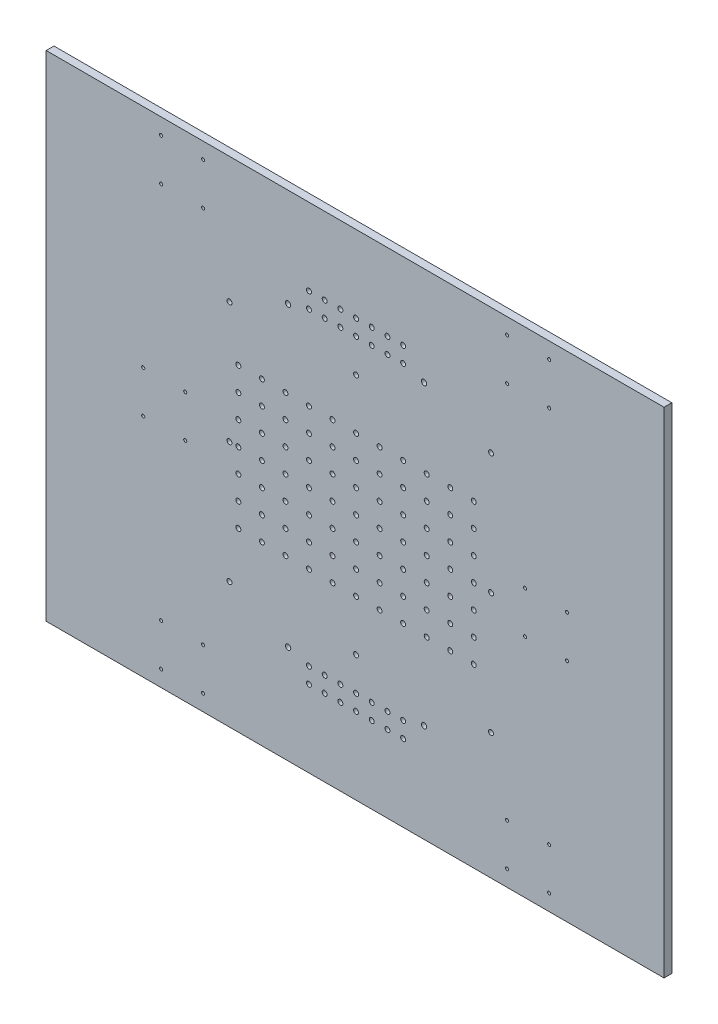
from build123d import *

# Parameters (mm, degrees)
SKETCH1_W                                 = 500
SKETCH1_H                                 = 400
BASE_PLATE_EXTRUDE_DEPTH                  = 6.3
SKETCH2_R                                 = 1.25
TRIPOD_ADAPATER_FASTENERS_THRU_HOLE_DEPTH = 321.218191238
SKETCH3_R                                 = 2
SKETCH3_R_2                               = 2.15
PLATE_TO_PLATE_MNT_THRU_HOLE_DEPTH        = 321.218191238
SKETCH4_R                                 = 2
CENTER_PERFORATION_THRU_HOLE_DEPTH        = 321.218191238
SKETCH5_R                                 = 2
SIDE_PERFORATION_THRU_HOLE_DEPTH          = 321.218191238


with BuildPart() as part:
    # Sketch1 → Base_Plate-Extrude (new body)
    with BuildSketch(Plane.XY):
        Rectangle(SKETCH1_W, SKETCH1_H)
    extrude(amount=BASE_PLATE_EXTRUDE_DEPTH)

    # Sketch2 → Tripod_Adapater_Fasteners-Thru-Hole (cut, through all)
    with BuildSketch(Plane.XY.offset(6.3)):
        with Locations((157, 153)):
            Circle(SKETCH2_R)
        with Locations((157, 187)):
            Circle(SKETCH2_R)
        with Locations((123, 187)):
            Circle(SKETCH2_R)
        with Locations((123, 153)):
            Circle(SKETCH2_R)
        with Locations((157, -153)):
            Circle(SKETCH2_R)
        with Locations((157, -187)):
            Circle(SKETCH2_R)
        with Locations((123, -153)):
            Circle(SKETCH2_R)
        with Locations((123, -187)):
            Circle(SKETCH2_R)
        with Locations((-137.448637287, 17)):
            Circle(SKETCH2_R)
        with Locations((-137.448637287, -17)):
            Circle(SKETCH2_R)
        with Locations((-171.448637287, -17)):
            Circle(SKETCH2_R)
        with Locations((-171.448637287, 17)):
            Circle(SKETCH2_R)
        with Locations(Location((171.448637287, -17, 0), (0, 0, 180))):
            Circle(SKETCH2_R)
        with Locations(Location((171.448637287, 17, 0), (0, 0, 180))):
            Circle(SKETCH2_R)
        with Locations(Location((137.448637287, 17, 0), (0, 0, 180))):
            Circle(SKETCH2_R)
        with Locations(Location((137.448637287, -17, 0), (0, 0, 180))):
            Circle(SKETCH2_R)
        with Locations(Location((-157, -153, 0), (0, 0, 180))):
            Circle(SKETCH2_R)
        with Locations(Location((-123, -153, 0), (0, 0, 180))):
            Circle(SKETCH2_R)
        with Locations(Location((-123, -187, 0), (0, 0, 180))):
            Circle(SKETCH2_R)
        with Locations(Location((-157, -187, 0), (0, 0, 180))):
            Circle(SKETCH2_R)
        with Locations(Location((-157, 187, 0), (0, 0, 180))):
            Circle(SKETCH2_R)
        with Locations(Location((-123, 187, 0), (0, 0, 180))):
            Circle(SKETCH2_R)
        with Locations(Location((-123, 153, 0), (0, 0, 180))):
            Circle(SKETCH2_R)
        with Locations(Location((-157, 153, 0), (0, 0, 180))):
            Circle(SKETCH2_R)
    extrude(amount=-TRIPOD_ADAPATER_FASTENERS_THRU_HOLE_DEPTH, mode=Mode.SUBTRACT)

    # Sketch3 → Plate_to_Plate_Mnt-Thru-Hole (cut, through all)
    with BuildSketch(Plane.XY.offset(6.3)):
        with Locations((110, 98)):
            Circle(SKETCH3_R)
        with Locations((0.78, 98)):
            Circle(SKETCH3_R)
        with Locations((-101.66, 98)):
            Circle(SKETCH3_R)
        with Locations((-101.66, -98)):
            Circle(SKETCH3_R)
        with Locations((0.78, -98)):
            Circle(SKETCH3_R)
        with Locations((110, -98)):
            Circle(SKETCH3_R)
        with Locations((110, 0)):
            Circle(SKETCH3_R)
        with Locations((-101.66, 0)):
            Circle(SKETCH3_R)
        with Locations((55.78, -120.25)):
            Circle(SKETCH3_R_2)
        with Locations((-54.22, -120.25)):
            Circle(SKETCH3_R_2)
        with Locations((-54.22, 120.25)):
            Circle(SKETCH3_R_2)
        with Locations((55.78, 120.25)):
            Circle(SKETCH3_R_2)
    extrude(amount=-PLATE_TO_PLATE_MNT_THRU_HOLE_DEPTH, mode=Mode.SUBTRACT)

    # Sketch4 → Center_Perforation-Thru-Hole (cut, through all)
    with BuildSketch(Plane.XY.offset(6.3)):
        with Locations((-94.47, 0)):
            Circle(SKETCH4_R)
        with Locations((-75.42, 0)):
            Circle(SKETCH4_R)
        with Locations((-56.37, 0)):
            Circle(SKETCH4_R)
        with Locations((-37.32, 0)):
            Circle(SKETCH4_R)
        with Locations((-18.27, 0)):
            Circle(SKETCH4_R)
        with Locations((0.78, 0)):
            Circle(SKETCH4_R)
        with Locations((19.83, 0)):
            Circle(SKETCH4_R)
        with Locations((38.88, 0)):
            Circle(SKETCH4_R)
        with Locations((57.93, 0)):
            Circle(SKETCH4_R)
        with Locations((76.98, 0)):
            Circle(SKETCH4_R)
        with Locations((96.03, 0)):
            Circle(SKETCH4_R)
        with Locations((-94.47, 19.05)):
            Circle(SKETCH4_R)
        with Locations((-75.42, 19.05)):
            Circle(SKETCH4_R)
        with Locations((-56.37, 19.05)):
            Circle(SKETCH4_R)
        with Locations((-37.32, 19.05)):
            Circle(SKETCH4_R)
        with Locations((-18.27, 19.05)):
            Circle(SKETCH4_R)
        with Locations((0.78, 19.05)):
            Circle(SKETCH4_R)
        with Locations((19.83, 19.05)):
            Circle(SKETCH4_R)
        with Locations((38.88, 19.05)):
            Circle(SKETCH4_R)
        with Locations((57.93, 19.05)):
            Circle(SKETCH4_R)
        with Locations((76.98, 19.05)):
            Circle(SKETCH4_R)
        with Locations((96.03, 19.05)):
            Circle(SKETCH4_R)
        with Locations((-94.47, 38.1)):
            Circle(SKETCH4_R)
        with Locations((-75.42, 38.1)):
            Circle(SKETCH4_R)
        with Locations((-56.37, 38.1)):
            Circle(SKETCH4_R)
        with Locations((-37.32, 38.1)):
            Circle(SKETCH4_R)
        with Locations((-18.27, 38.1)):
            Circle(SKETCH4_R)
        with Locations((0.78, 38.1)):
            Circle(SKETCH4_R)
        with Locations((19.83, 38.1)):
            Circle(SKETCH4_R)
        with Locations((38.88, 38.1)):
            Circle(SKETCH4_R)
        with Locations((57.93, 38.1)):
            Circle(SKETCH4_R)
        with Locations((76.98, 38.1)):
            Circle(SKETCH4_R)
        with Locations((96.03, 38.1)):
            Circle(SKETCH4_R)
        with Locations((-94.47, 57.15)):
            Circle(SKETCH4_R)
        with Locations((-75.42, 57.15)):
            Circle(SKETCH4_R)
        with Locations((-56.37, 57.15)):
            Circle(SKETCH4_R)
        with Locations((-37.32, 57.15)):
            Circle(SKETCH4_R)
        with Locations((-18.27, 57.15)):
            Circle(SKETCH4_R)
        with Locations((0.78, 57.15)):
            Circle(SKETCH4_R)
        with Locations((19.83, 57.15)):
            Circle(SKETCH4_R)
        with Locations((38.88, 57.15)):
            Circle(SKETCH4_R)
        with Locations((57.93, 57.15)):
            Circle(SKETCH4_R)
        with Locations((76.98, 57.15)):
            Circle(SKETCH4_R)
        with Locations((96.03, 57.15)):
            Circle(SKETCH4_R)
        with Locations((-94.47, -19.05)):
            Circle(SKETCH4_R)
        with Locations((-75.42, -19.05)):
            Circle(SKETCH4_R)
        with Locations((-56.37, -19.05)):
            Circle(SKETCH4_R)
        with Locations((-37.32, -19.05)):
            Circle(SKETCH4_R)
        with Locations((-18.27, -19.05)):
            Circle(SKETCH4_R)
        with Locations((0.78, -19.05)):
            Circle(SKETCH4_R)
        with Locations((19.83, -19.05)):
            Circle(SKETCH4_R)
        with Locations((38.88, -19.05)):
            Circle(SKETCH4_R)
        with Locations((57.93, -19.05)):
            Circle(SKETCH4_R)
        with Locations((76.98, -19.05)):
            Circle(SKETCH4_R)
        with Locations((96.03, -19.05)):
            Circle(SKETCH4_R)
        with Locations((-94.47, -38.1)):
            Circle(SKETCH4_R)
        with Locations((-75.42, -38.1)):
            Circle(SKETCH4_R)
        with Locations((-56.37, -38.1)):
            Circle(SKETCH4_R)
        with Locations((-37.32, -38.1)):
            Circle(SKETCH4_R)
        with Locations((-18.27, -38.1)):
            Circle(SKETCH4_R)
        with Locations((0.78, -38.1)):
            Circle(SKETCH4_R)
        with Locations((19.83, -38.1)):
            Circle(SKETCH4_R)
        with Locations((38.88, -38.1)):
            Circle(SKETCH4_R)
        with Locations((57.93, -38.1)):
            Circle(SKETCH4_R)
        with Locations((76.98, -38.1)):
            Circle(SKETCH4_R)
        with Locations((96.03, -38.1)):
            Circle(SKETCH4_R)
        with Locations((-94.47, -57.15)):
            Circle(SKETCH4_R)
        with Locations((-75.42, -57.15)):
            Circle(SKETCH4_R)
        with Locations((-56.37, -57.15)):
            Circle(SKETCH4_R)
        with Locations((-37.32, -57.15)):
            Circle(SKETCH4_R)
        with Locations((-18.27, -57.15)):
            Circle(SKETCH4_R)
        with Locations((0.78, -57.15)):
            Circle(SKETCH4_R)
        with Locations((19.83, -57.15)):
            Circle(SKETCH4_R)
        with Locations((38.88, -57.15)):
            Circle(SKETCH4_R)
        with Locations((57.93, -57.15)):
            Circle(SKETCH4_R)
        with Locations((76.98, -57.15)):
            Circle(SKETCH4_R)
        with Locations((96.03, -57.15)):
            Circle(SKETCH4_R)
    extrude(amount=-CENTER_PERFORATION_THRU_HOLE_DEPTH, mode=Mode.SUBTRACT)

    # Sketch5 → Side-Perforation-Thru-Hole (cut, through all)
    with BuildSketch(Plane.XY.offset(6.3)):
        with Locations((0.78, -125.08)):
            Circle(SKETCH5_R)
        with Locations((13.48, -125.08)):
            Circle(SKETCH5_R)
        with Locations((26.18, -125.08)):
            Circle(SKETCH5_R)
        with Locations((38.88, -125.08)):
            Circle(SKETCH5_R)
        with Locations((-11.92, -125.08)):
            Circle(SKETCH5_R)
        with Locations((-24.62, -125.08)):
            Circle(SKETCH5_R)
        with Locations((-37.32, -125.08)):
            Circle(SKETCH5_R)
        with Locations((0.78, -137.78)):
            Circle(SKETCH5_R)
        with Locations((13.48, -137.78)):
            Circle(SKETCH5_R)
        with Locations((26.18, -137.78)):
            Circle(SKETCH5_R)
        with Locations((38.88, -137.78)):
            Circle(SKETCH5_R)
        with Locations((-11.92, -137.78)):
            Circle(SKETCH5_R)
        with Locations((-24.62, -137.78)):
            Circle(SKETCH5_R)
        with Locations((-37.32, -137.78)):
            Circle(SKETCH5_R)
        with Locations(Location((-37.32, 137.78, 0), (0, 0, 180))):
            Circle(SKETCH5_R)
        with Locations(Location((-24.62, 137.78, 0), (0, 0, 180))):
            Circle(SKETCH5_R)
        with Locations(Location((-11.92, 137.78, 0), (0, 0, 180))):
            Circle(SKETCH5_R)
        with Locations(Location((38.88, 137.78, 0), (0, 0, 180))):
            Circle(SKETCH5_R)
        with Locations(Location((26.18, 137.78, 0), (0, 0, 180))):
            Circle(SKETCH5_R)
        with Locations(Location((13.48, 137.78, 0), (0, 0, 180))):
            Circle(SKETCH5_R)
        with Locations(Location((0.78, 137.78, 0), (0, 0, 180))):
            Circle(SKETCH5_R)
        with Locations(Location((-37.32, 125.08, 0), (0, 0, 180))):
            Circle(SKETCH5_R)
        with Locations(Location((-24.62, 125.08, 0), (0, 0, 180))):
            Circle(SKETCH5_R)
        with Locations(Location((-11.92, 125.08, 0), (0, 0, 180))):
            Circle(SKETCH5_R)
        with Locations(Location((38.88, 125.08, 0), (0, 0, 180))):
            Circle(SKETCH5_R)
        with Locations(Location((26.18, 125.08, 0), (0, 0, 180))):
            Circle(SKETCH5_R)
        with Locations(Location((13.48, 125.08, 0), (0, 0, 180))):
            Circle(SKETCH5_R)
        with Locations(Location((0.78, 125.08, 0), (0, 0, 180))):
            Circle(SKETCH5_R)
    extrude(amount=-SIDE_PERFORATION_THRU_HOLE_DEPTH, mode=Mode.SUBTRACT)


solid = part.part
